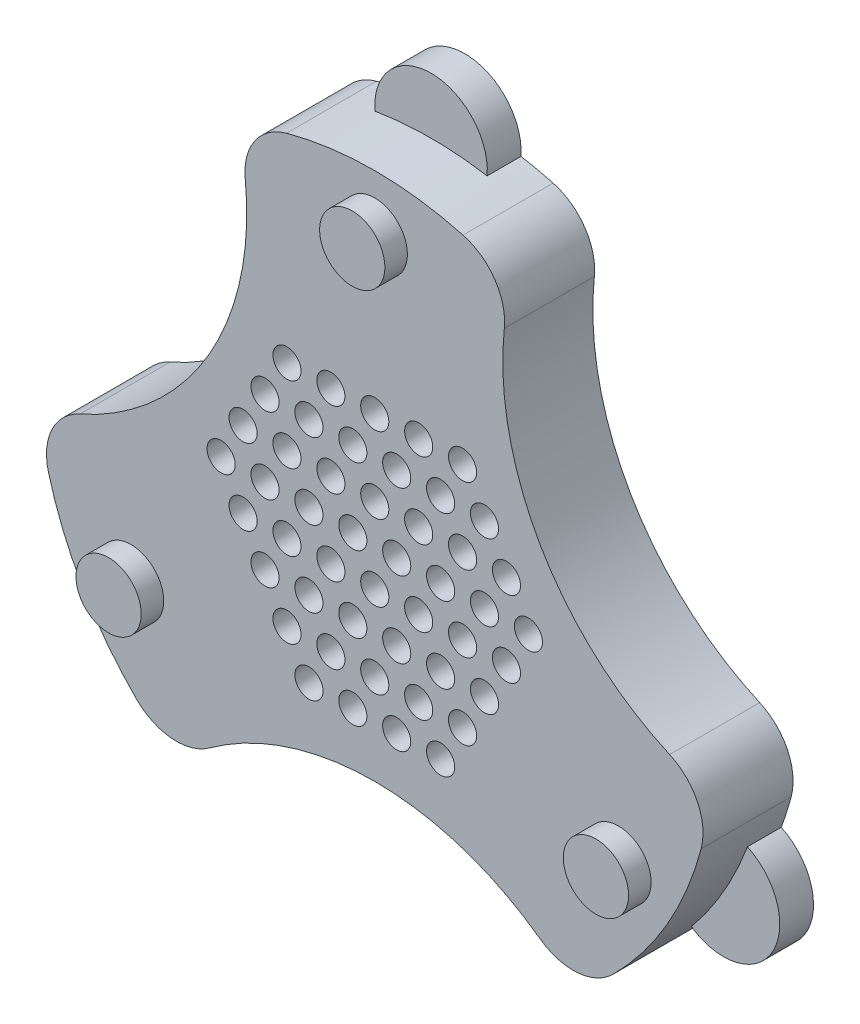
from build123d import *

# Parameters (mm, degrees)
SKETCH2_R           = 19
SKETCH2_R_2         = 1.25
SKETCH2_R_3         = 1.249999997
SKETCH2_R_4         = 1.250000002
SKETCH2_R_5         = 1.250000001
SKETCH2_R_6         = 1.249999999
SKETCH2_R_7         = 1.249999998
BOSS_EXTRUDE1_DEPTH = 8
SKETCH3_R           = 30
SKETCH3_R_2         = 17.487995661
BOSS_EXTRUDE2_DEPTH = 8
SKETCH4_R           = 2.9
BOSS_EXTRUDE3_DEPTH = 2
SKETCH6_R           = 5
BOSS_EXTRUDE4_DEPTH = 3
SKETCH5_R           = 3
CUT_EXTRUDE1_DEPTH  = 3
SKETCH7_R           = 25
CUT_EXTRUDE2_DEPTH  = 8
FILLET2_R           = 5


with BuildPart() as part:
    # Sketch2 → Boss-Extrude1 (new body)
    with BuildSketch(Plane.XY.offset(10)):
        Circle(SKETCH2_R)
        with Locations((0, -2.215732779)):
            Circle(SKETCH2_R_2, mode=Mode.SUBTRACT)
        with Locations((3.9, -2.215732779)):
            Circle(SKETCH2_R_2, mode=Mode.SUBTRACT)
        with Locations((7.8, -2.215732779)):
            Circle(SKETCH2_R_2, mode=Mode.SUBTRACT)
        with Locations((11.7, -2.215732779)):
            Circle(SKETCH2_R_2, mode=Mode.SUBTRACT)
        with Locations((1.95, -5.593231854)):
            Circle(SKETCH2_R_2, mode=Mode.SUBTRACT)
        with Locations((3.9, -8.970730929)):
            Circle(SKETCH2_R_2, mode=Mode.SUBTRACT)
        with Locations((5.850000003, -12.348230002)):
            Circle(SKETCH2_R_3, mode=Mode.SUBTRACT)
        with Locations((-1.95, -5.593231854)):
            Circle(SKETCH2_R_2, mode=Mode.SUBTRACT)
        with Locations((-3.9, -8.970730929)):
            Circle(SKETCH2_R_2, mode=Mode.SUBTRACT)
        with Locations((-5.85, -12.348230004)):
            Circle(SKETCH2_R_2, mode=Mode.SUBTRACT)
        with Locations((-3.9, -2.215732779)):
            Circle(SKETCH2_R_2, mode=Mode.SUBTRACT)
        with Locations((-7.8, -2.215732779)):
            Circle(SKETCH2_R_2, mode=Mode.SUBTRACT)
        with Locations((-11.7, -2.215732779)):
            Circle(SKETCH2_R_2, mode=Mode.SUBTRACT)
        with Locations((-1.950000001, 1.161766295)):
            Circle(SKETCH2_R_4, mode=Mode.SUBTRACT)
        with Locations((-3.9, 4.53926537)):
            Circle(SKETCH2_R_2, mode=Mode.SUBTRACT)
        with Locations((-5.85, 7.916764445)):
            Circle(SKETCH2_R_2, mode=Mode.SUBTRACT)
        with Locations((-7.8, 11.29426352)):
            Circle(SKETCH2_R_2, mode=Mode.SUBTRACT)
        with Locations((1.95, 1.161766295)):
            Circle(SKETCH2_R_5, mode=Mode.SUBTRACT)
        with Locations((3.9, 4.53926537)):
            Circle(SKETCH2_R_2, mode=Mode.SUBTRACT)
        with Locations((5.85, 7.916764445)):
            Circle(SKETCH2_R_2, mode=Mode.SUBTRACT)
        with Locations((7.8, 11.29426352)):
            Circle(SKETCH2_R_2, mode=Mode.SUBTRACT)
        with Locations((5.85, 1.161766295)):
            Circle(SKETCH2_R_2, mode=Mode.SUBTRACT)
        with Locations((7.8, 4.53926537)):
            Circle(SKETCH2_R_2, mode=Mode.SUBTRACT)
        with Locations((9.75, 1.161766295)):
            Circle(SKETCH2_R_2, mode=Mode.SUBTRACT)
        with Locations((11.7, 4.53926537)):
            Circle(SKETCH2_R_2, mode=Mode.SUBTRACT)
        with Locations((9.749099848, 7.918323553)):
            Circle(SKETCH2_R_2, mode=Mode.SUBTRACT)
        with Locations((13.650900152, 1.160207187)):
            Circle(SKETCH2_R_2, mode=Mode.SUBTRACT)
        with Locations((5.850000208, -5.594790783)):
            Circle(SKETCH2_R_2, mode=Mode.SUBTRACT)
        with Locations((9.750000208, -5.594790782)):
            Circle(SKETCH2_R_6, mode=Mode.SUBTRACT)
        with Locations((7.800000209, -8.972289857)):
            Circle(SKETCH2_R_7, mode=Mode.SUBTRACT)
        with Locations((-0.00134976, -8.973069502)):
            Circle(SKETCH2_R_2, mode=Mode.SUBTRACT)
        with Locations((1.94865024, -12.350568576)):
            Circle(SKETCH2_R_2, mode=Mode.SUBTRACT)
        with Locations((-1.95134976, -12.350568576)):
            Circle(SKETCH2_R_2, mode=Mode.SUBTRACT)
        with Locations((-5.852699936, -5.594791143)):
            Circle(SKETCH2_R_2, mode=Mode.SUBTRACT)
        with Locations((-7.802699936, -8.972290217)):
            Circle(SKETCH2_R_2, mode=Mode.SUBTRACT)
        with Locations((-9.752699936, -5.594791143)):
            Circle(SKETCH2_R_2, mode=Mode.SUBTRACT)
        with Locations((-5.852700144, 1.161765936)):
            Circle(SKETCH2_R_2, mode=Mode.SUBTRACT)
        with Locations((-9.752700144, 1.161765936)):
            Circle(SKETCH2_R_2, mode=Mode.SUBTRACT)
        with Locations((-7.802700144, 4.53926501)):
            Circle(SKETCH2_R_2, mode=Mode.SUBTRACT)
        with Locations((-11.702700144, 4.53926501)):
            Circle(SKETCH2_R_2, mode=Mode.SUBTRACT)
        with Locations((-9.751799992, 7.918323194)):
            Circle(SKETCH2_R_2, mode=Mode.SUBTRACT)
        with Locations((-13.653600295, 1.160206827)):
            Circle(SKETCH2_R_2, mode=Mode.SUBTRACT)
        with Locations((-0.001350176, 4.540044654)):
            Circle(SKETCH2_R_5, mode=Mode.SUBTRACT)
        with Locations((-1.951350176, 7.917543729)):
            Circle(SKETCH2_R_2, mode=Mode.SUBTRACT)
        with Locations((1.948649824, 7.917543729)):
            Circle(SKETCH2_R_2, mode=Mode.SUBTRACT)
        with Locations((-0.001350176, 11.295042804)):
            Circle(SKETCH2_R_2, mode=Mode.SUBTRACT)
        with Locations((3.900450128, 11.295042804)):
            Circle(SKETCH2_R_2, mode=Mode.SUBTRACT)
        with Locations((-3.903150479, 11.295042804)):
            Circle(SKETCH2_R_2, mode=Mode.SUBTRACT)
    extrude(amount=BOSS_EXTRUDE1_DEPTH)

    # Sketch3 → Boss-Extrude2 (add)
    with BuildSketch(Plane.XY.offset(18)):
        Circle(SKETCH3_R)
        Circle(SKETCH3_R_2, mode=Mode.SUBTRACT)
    extrude(amount=-BOSS_EXTRUDE2_DEPTH)

    # Sketch4 → Boss-Extrude3 (add)
    with BuildSketch(Plane.XY.offset(18)):
        with Locations((0, 25)):
            Circle(SKETCH4_R)
        with Locations((21.650635095, -12.5)):
            Circle(SKETCH4_R)
        with Locations((-21.650635095, -12.5)):
            Circle(SKETCH4_R)
    extrude(amount=BOSS_EXTRUDE3_DEPTH)

    # Sketch6 → Boss-Extrude4 (add)
    with BuildSketch(Plane(origin=(0, 0, 10), x_dir=(-1, 0, 0), z_dir=(0, 0, -1))):
        with Locations((0, 30)):
            Circle(SKETCH6_R)
        with Locations((25.980762114, -15)):
            Circle(SKETCH6_R)
        with Locations((-25.980762114, -15)):
            Circle(SKETCH6_R)
    extrude(amount=-BOSS_EXTRUDE4_DEPTH)

    # Sketch5 → Cut-Extrude1 (cut)
    with BuildSketch(Plane(origin=(0, 0, 10), x_dir=(-1, 0, 0), z_dir=(0, 0, -1))):
        with Locations((0, 25)):
            Circle(SKETCH5_R)
        with Locations((21.650635095, -12.5)):
            Circle(SKETCH5_R)
        with Locations((-21.650635095, -12.5)):
            Circle(SKETCH5_R)
    extrude(amount=-CUT_EXTRUDE1_DEPTH, mode=Mode.SUBTRACT)

    # Sketch7 → Cut-Extrude2 (cut)
    with BuildSketch(Plane(origin=(0, 0, 10), x_dir=(-1, 0, 0), z_dir=(0, 0, -1))):
        with Locations((36.373066959, 21)):
            Circle(SKETCH7_R)
        with Locations((0, -42)):
            Circle(SKETCH7_R)
        with Locations((-36.373066959, 21)):
            Circle(SKETCH7_R)
    extrude(amount=-CUT_EXTRUDE2_DEPTH, mode=Mode.SUBTRACT)

    # Fillet2
    fillet2_edges = [part.edges().sort_by_distance(p)[0] for p in [
        (29.836243213, -3.130270104, 14),
        (12.207228175, 27.404079628, 14),
        (-12.207228175, 27.404079628, 14),
        (-29.836243213, -3.130270104, 14),
        (-17.629015038, -24.273809524, 14),
        (17.629015038, -24.273809524, 14),
    ]]
    fillet(fillet2_edges, radius=FILLET2_R)


solid = part.part
